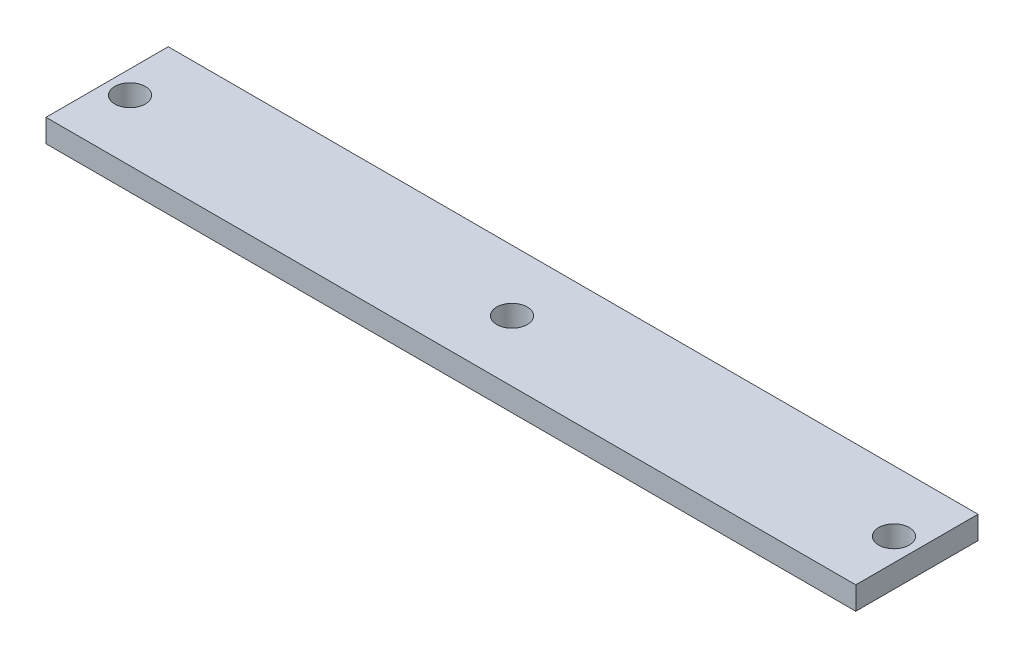
from build123d import *

# Parameters (mm, degrees)
SKETCH_1_W          = 106
SKETCH_1_H          = 16
EXTRUDE_1_DEPTH     = 1.5
SKETCH_2_R          = 2
CUT_EXTRUDE_1_DEPTH = 55.536684901


with BuildPart() as part:
    # 스케치1 → 보스-돌출1 (new, symmetric)
    with BuildSketch(Plane(origin=(0, 0, 0), x_dir=(1, 0, 0), z_dir=(0, 1, 0))):
        Rectangle(SKETCH_1_W, SKETCH_1_H)
    extrude(amount=EXTRUDE_1_DEPTH, both=True)

    # 스케치2 → 컷-돌출1 (cut, through all)
    with BuildSketch(Plane(origin=(0, 1.5, 4.5), x_dir=(-1, 0, 0), z_dir=(0, -1, 0))):
        with Locations(Location((0, 4.5, 0), (0, 0, 90))):
            Circle(SKETCH_2_R)
        with Locations(Location((50, 4.5, 0), (0, 0, 90))):
            Circle(SKETCH_2_R)
        with Locations(Location((-50, 4.5, 0), (0, 0, 90))):
            Circle(SKETCH_2_R)
    extrude(amount=CUT_EXTRUDE_1_DEPTH, mode=Mode.SUBTRACT)


solid = part.part
